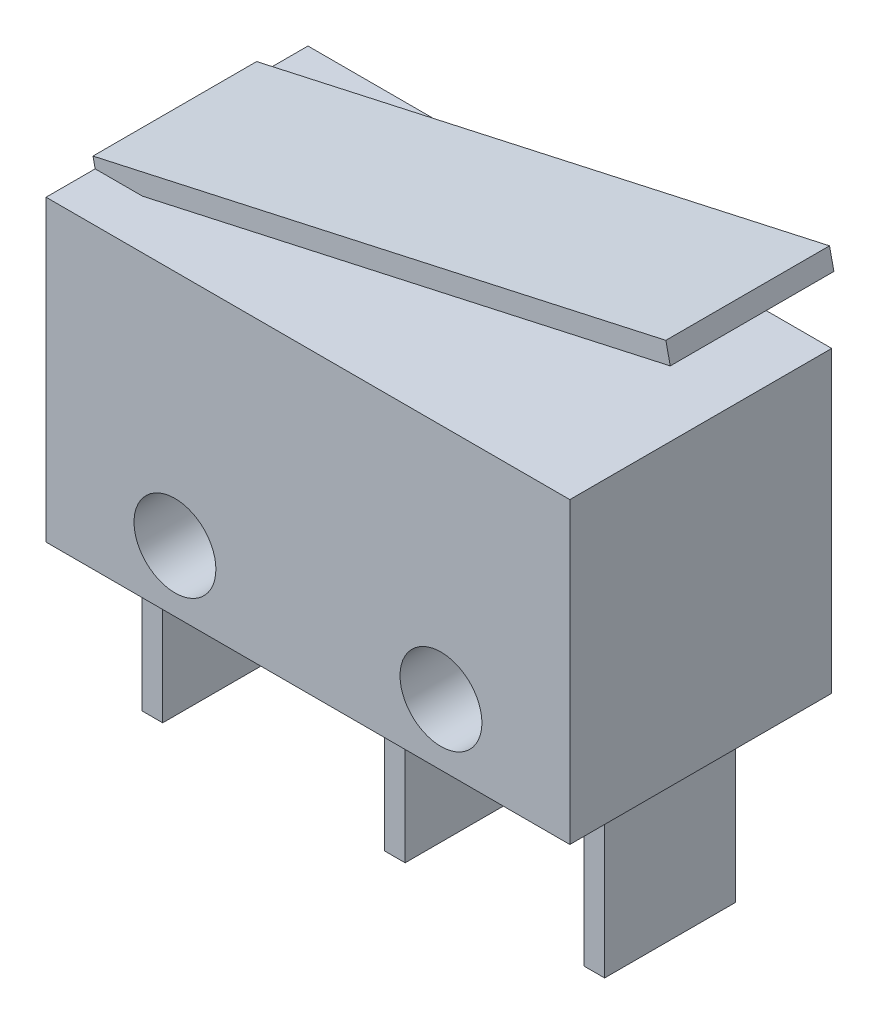
from build123d import *

# Parameters (mm, degrees)
SKETCH_1_W        = 12.8
SKETCH_1_H        = 7.3
SKETCH_1_R        = 1
EXTRUDE_1_DEPTH   = 3.2
SKETCH_2_W        = 0.5
SKETCH_2_H        = 3.2
EXTRUDE_1_2_DEPTH = 4
EXTRUDE_2_DEPTH   = 2


with BuildPart() as part:
    # Эскиз1 → Extrude 1 (new, symmetric)
    with BuildSketch(Plane.XY):
        with Locations((-6.4, 3.65)):
            Rectangle(SKETCH_1_W, SKETCH_1_H)
        with Locations((-9.65, 1.5)):
            Circle(SKETCH_1_R, mode=Mode.SUBTRACT)
        with Locations(Location((-3.15, 1.5, 0), (0, 0, 180))):
            Circle(SKETCH_1_R, mode=Mode.SUBTRACT)
    extrude(amount=EXTRUDE_1_DEPTH, both=True)

    # Эскиз2 → Extrude 1 2 (add)
    with BuildSketch(Plane.XZ):
        with Locations((-11.8, 0)):
            Rectangle(SKETCH_2_W, SKETCH_2_H)
        with Locations((-5.874787357, 0)):
            Rectangle(SKETCH_2_W, SKETCH_2_H)
        with Locations((-1, 0)):
            Rectangle(SKETCH_2_W, SKETCH_2_H)
    extrude(amount=EXTRUDE_1_2_DEPTH)

    # Эскиз3 → Вытянуть-Тонкостенный2 (add, symmetric)
    with BuildSketch(Plane.XY):
        Polygon((-12.745952005, 7.055912282), (1.254047995, 10.155912282), (1.145952005, 10.644087718), (-12.854047995, 7.544087718), align=None)
    extrude(amount=EXTRUDE_2_DEPTH, both=True)


solid = part.part
